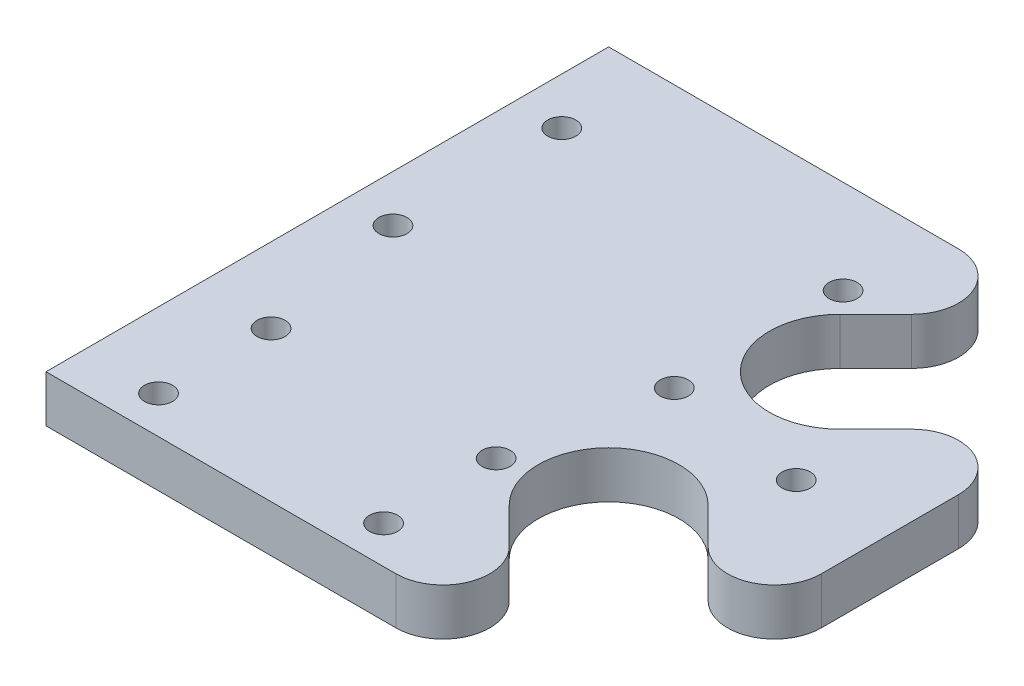
from build123d import *

# Parameters (mm, degrees)
SKETCH_1_W          = 60
SKETCH_1_H          = 60
EXTRUDE_1_DEPTH     = 5
CUT_EXTRUDE_1_DEPTH = 43.720018727
FILLET_1_R          = 5
SKETCH_3_R          = 1.5
CUT_EXTRUDE_2_DEPTH = 43.720018727


with BuildPart() as part:
    # 草图1 → 凸台-拉伸1 (new body)
    with BuildSketch(Plane(origin=(0, 0, 0), x_dir=(1, 0, 0), z_dir=(0, 1, 0))):
        Rectangle(SKETCH_1_W, SKETCH_1_H)
    extrude(amount=EXTRUDE_1_DEPTH)

    # 草图2 → 切除-拉伸1 (cut, through all)
    with BuildSketch(Plane(origin=(0, 5, 0), x_dir=(1, 0, 0), z_dir=(0, 1, 0))):
        with BuildLine():
            Line((19.393398282, 30), (7.019029611, 17.625631329))
            ThreePointArc((7.019029611, 17.625631329), (7.019029611, 7.019029611), (17.625631329, 7.019029611))
            Line((17.625631329, 7.019029611), (30, 19.393398282))
            Line((30, 19.393398282), (30, 30))
            Line((30, 30), (19.393398282, 30))
        make_face()
        with BuildLine():
            Line((19.393398282, -30), (30, -30))
            Line((30, -30), (30, -19.393398282))
            Line((30, -19.393398282), (17.625631329, -7.019029611))
            ThreePointArc((17.625631329, -7.019029611), (7.019029611, -7.019029611), (7.019029611, -17.625631329))
            Line((7.019029611, -17.625631329), (19.393398282, -30))
        make_face()
    extrude(amount=-CUT_EXTRUDE_1_DEPTH, mode=Mode.SUBTRACT)

    # 圆角1
    fillet_1_edges = [part.edges().sort_by_distance(p)[0] for p in [
        (30, 2.5, -19.393398282),
        (19.393398282, 2.5, -30),
        (19.393398282, 2.5, 30),
        (30, 2.5, 19.393398282),
    ]]
    fillet(fillet_1_edges, radius=FILLET_1_R)

    # 草图3 → 切除-拉伸2 (cut, through all)
    with BuildSketch(Plane(origin=(0, 5, 0), x_dir=(1, 0, 0), z_dir=(0, 1, 0))):
        with Locations(Location((20, 0, 0), (0, 0, 270))):
            Circle(SKETCH_3_R)
        with Locations(Location((-22, -14, 0), (0, 0, 270))):
            Circle(SKETCH_3_R)
        with Locations(Location((2, -14, 0), (0, 0, 90))):
            Circle(SKETCH_3_R)
        with Locations(Location((2, -26, 0), (0, 0, 270))):
            Circle(SKETCH_3_R)
        with Locations(Location((-22, -26, 0), (0, 0, 90))):
            Circle(SKETCH_3_R)
        with Locations(Location((-25, 20, 0), (0, 0, 270))):
            Circle(SKETCH_3_R)
        with Locations(Location((5, 20, 0), (0, 0, 90))):
            Circle(SKETCH_3_R)
        with Locations(Location((-25, 2, 0), (0, 0, 270))):
            Circle(SKETCH_3_R)
        with Locations(Location((5, 2, 0), (0, 0, 270))):
            Circle(SKETCH_3_R)
    extrude(amount=-CUT_EXTRUDE_2_DEPTH, mode=Mode.SUBTRACT)


solid = part.part
